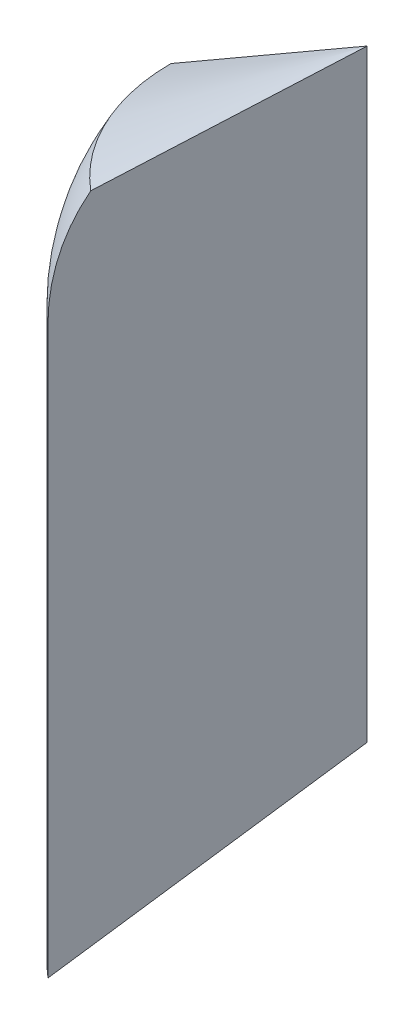
from build123d import *

# Parameters (mm, degrees)
REVOLVE1_ANGLE = 50


with BuildPart() as part:
    # Sketch1 → Revolve1 (revolve)
    with BuildSketch(Plane.XY):
        with BuildLine():
            Line((0, 106680), (-26396.45430735, 91440))
            ThreePointArc((-26396.45430735, 91440), (-29441.419185291, 84088.804494725), (-30480, 76200))
            Line((-30480, 76200), (-30480, 0))
            Line((-30480, 0), (0, 25575.756758284))
            Line((0, 25575.756758284), (0, 106680))
        make_face()
    revolve(axis=Axis((0, 0, 0), (0, 1, 0)), revolution_arc=REVOLVE1_ANGLE)


solid = part.part
